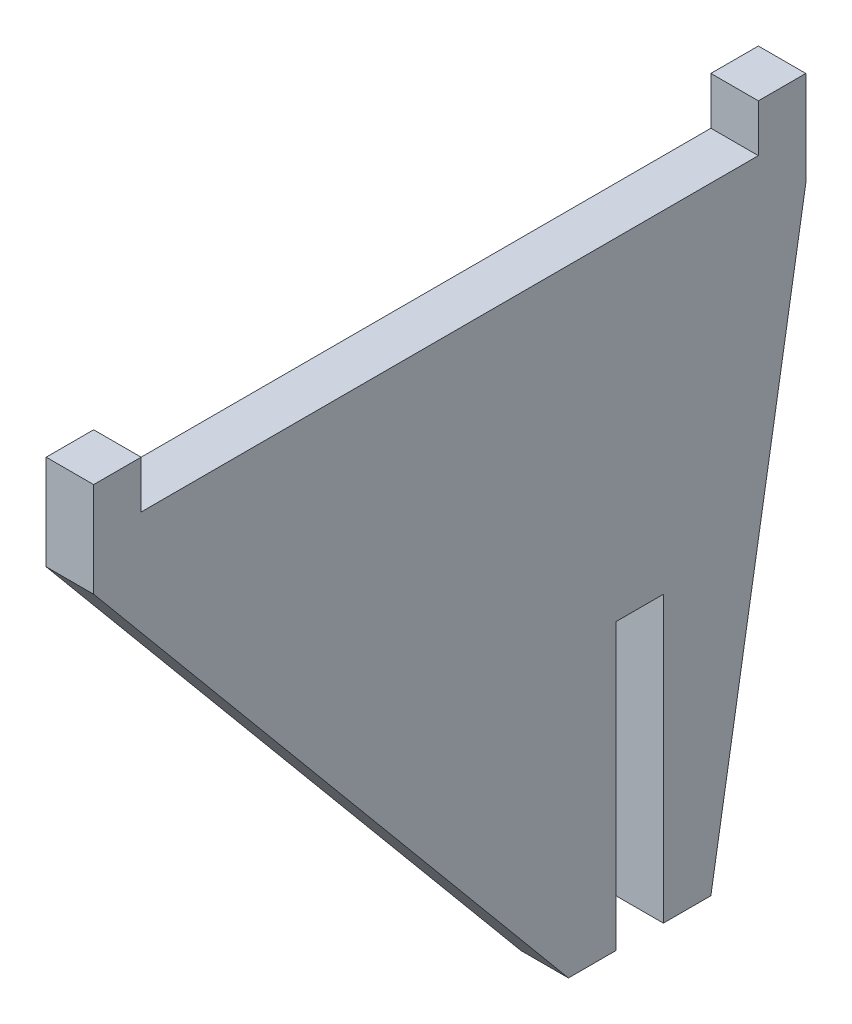
from build123d import *

# Parameters (mm, degrees)
BOSS_EXTRUDE1_DEPTH = 12.7


with BuildPart() as part:
    # Sketch1 → Boss-Extrude1 (new body)
    with BuildSketch(Plane(origin=(-161.170606325, 0, 0), x_dir=(0, 0, -1), z_dir=(1, 0, 0))):
        Polygon((-799.611357684, 609.6), (-786.911357684, 609.6), (-786.911357684, 596.9), (-621.811357684, 596.9), (-621.811357684, 609.6), (-609.111357684, 609.6), (-609.111357684, 596.9), (-609.111357684, 584.2), (-634.511357684, 431.8), (-647.211357684, 431.8), (-647.211357684, 508), (-659.911357684, 508), (-659.911357684, 431.8), (-672.611357684, 431.8), (-799.611357684, 584.2), (-799.611357684, 596.9), align=None)
    extrude(amount=BOSS_EXTRUDE1_DEPTH)


solid = part.part
